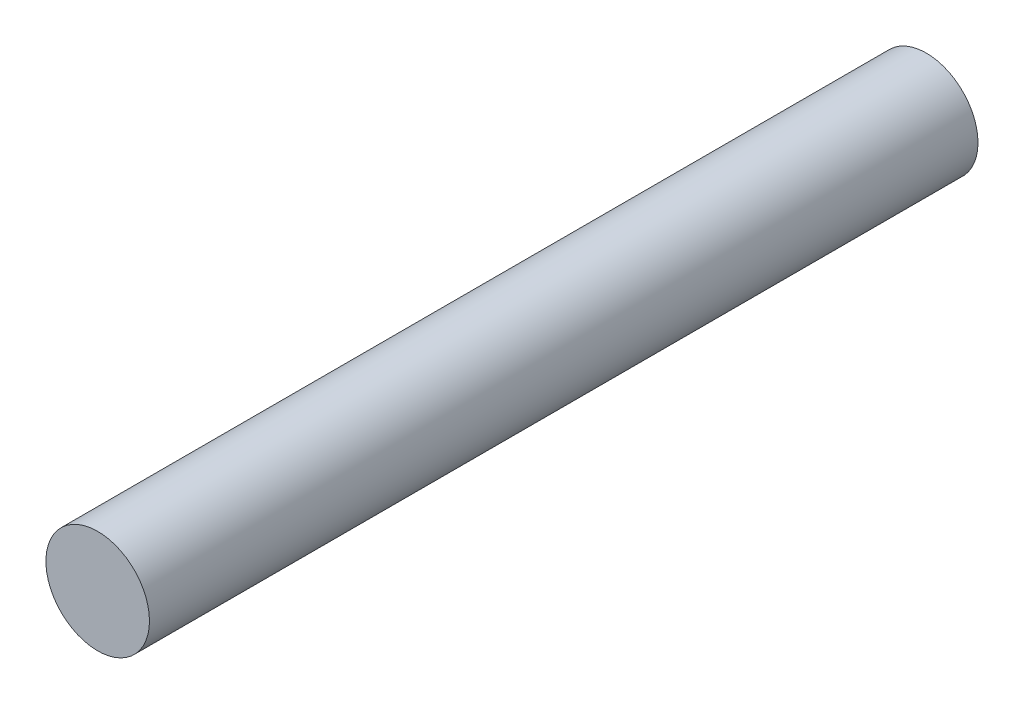
from build123d import *

# Parameters (mm, degrees)
SKETCH1_R           = 7.5
BOSS_EXTRUDE1_DEPTH = 120


with BuildPart() as part:
    # Sketch1 → Boss-Extrude1 (new body)
    with BuildSketch(Plane.XY):
        Circle(SKETCH1_R)
    extrude(amount=BOSS_EXTRUDE1_DEPTH)


solid = part.part
